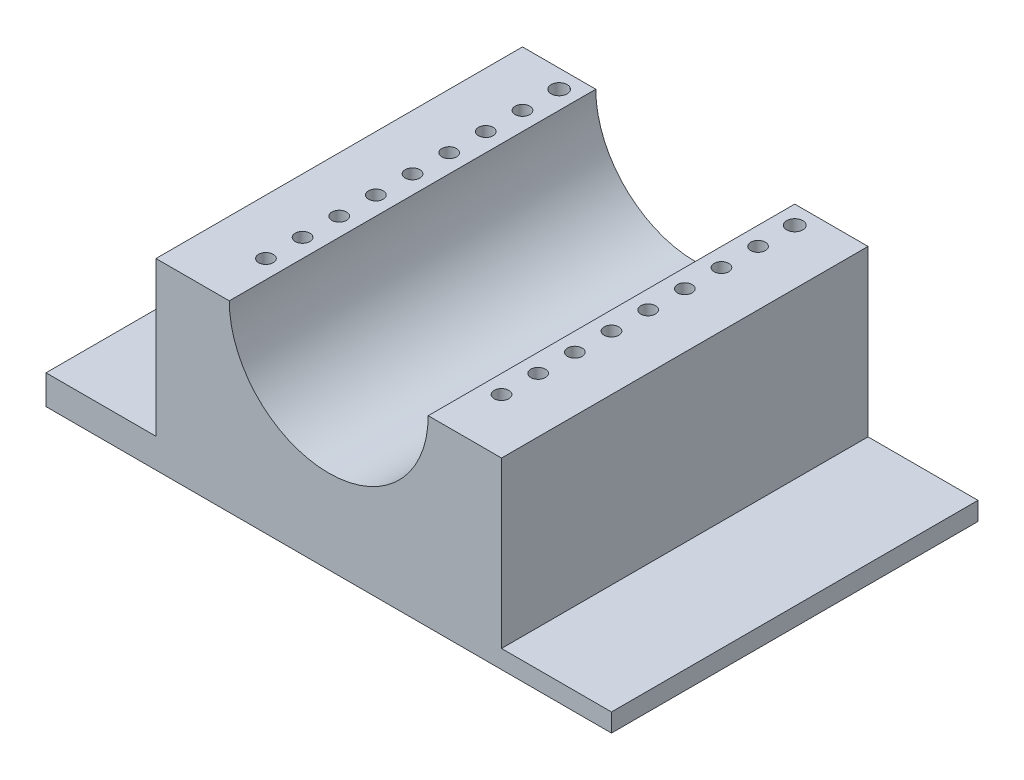
from build123d import *

# Parameters (mm, degrees)
BOSS_EXTRUDE1_DEPTH = 100
SKETCH2_R           = 2.2
SKETCH2_R_2         = 2
CUT_EXTRUDE2_DEPTH  = 6
SKETCH3_W           = 100
SKETCH3_H           = 8
BOSS_EXTRUDE2_DEPTH = 30
SKETCH4_W           = 100
SKETCH4_H           = 5
BOSS_EXTRUDE3_DEPTH = 30


with BuildPart() as part:
    # Sketch1 → Boss-Extrude1 (new body)
    with BuildSketch(Plane.XY):
        with BuildLine():
            Line((-57.167378994, 32.80487151), (-57.167378994, -17.19512849))
            Line((-57.167378994, -17.19512849), (37.112621006, -17.19512849))
            Line((37.112621006, -17.19512849), (37.112621006, 32.80487151))
            Line((37.112621006, 32.80487151), (17.112621006, 32.80487151))
            ThreePointArc((17.112621006, 32.80487151), (-10.027378994, 5.66487151), (-37.167378994, 32.80487151))
            Line((-37.167378994, 32.80487151), (-57.167378994, 32.80487151))
        make_face()
    extrude(amount=BOSS_EXTRUDE1_DEPTH)

    # Sketch2 → Cut-Extrude2 (cut)
    with BuildSketch(Plane(origin=(0, 32.80487151, 0), x_dir=(1, 0, 0), z_dir=(0, 1, 0))):
        with Locations((-42.167378994, -5)):
            Circle(SKETCH2_R)
        with Locations((-42.167378994, -15)):
            Circle(SKETCH2_R_2)
        with Locations((-42.167378994, -25)):
            Circle(SKETCH2_R_2)
        with Locations((-42.167378994, -35)):
            Circle(SKETCH2_R_2)
        with Locations((-42.167378994, -45)):
            Circle(SKETCH2_R_2)
        with Locations((-42.167378994, -55)):
            Circle(SKETCH2_R_2)
        with Locations((-42.167378994, -65)):
            Circle(SKETCH2_R_2)
        with Locations((-42.167378994, -75)):
            Circle(SKETCH2_R_2)
        with Locations((-42.167378994, -85)):
            Circle(SKETCH2_R_2)
        with Locations((22.112621006, -85)):
            Circle(SKETCH2_R_2)
        with Locations((22.112621006, -75)):
            Circle(SKETCH2_R_2)
        with Locations((22.112621006, -65)):
            Circle(SKETCH2_R_2)
        with Locations((22.112621006, -55)):
            Circle(SKETCH2_R_2)
        with Locations((22.112621006, -45)):
            Circle(SKETCH2_R_2)
        with Locations((22.112621006, -35)):
            Circle(SKETCH2_R_2)
        with Locations((22.112621006, -25)):
            Circle(SKETCH2_R_2)
        with Locations((22.112621006, -15)):
            Circle(SKETCH2_R_2)
        with Locations((22.112621006, -5)):
            Circle(SKETCH2_R)
    extrude(amount=-CUT_EXTRUDE2_DEPTH, mode=Mode.SUBTRACT)

    # Sketch3 → Boss-Extrude2 (add)
    with BuildSketch(Plane.ZY.offset(57.167378994)):
        with Locations((50, -13.19512849)):
            Rectangle(SKETCH3_W, SKETCH3_H)
    extrude(amount=BOSS_EXTRUDE2_DEPTH)

    # Sketch4 → Boss-Extrude3 (add)
    with BuildSketch(Plane(origin=(37.112621006, 0, 0), x_dir=(0, 0, -1), z_dir=(1, 0, 0))):
        with Locations((-50, -14.69512849)):
            Rectangle(SKETCH4_W, SKETCH4_H)
    extrude(amount=BOSS_EXTRUDE3_DEPTH)


solid = part.part
